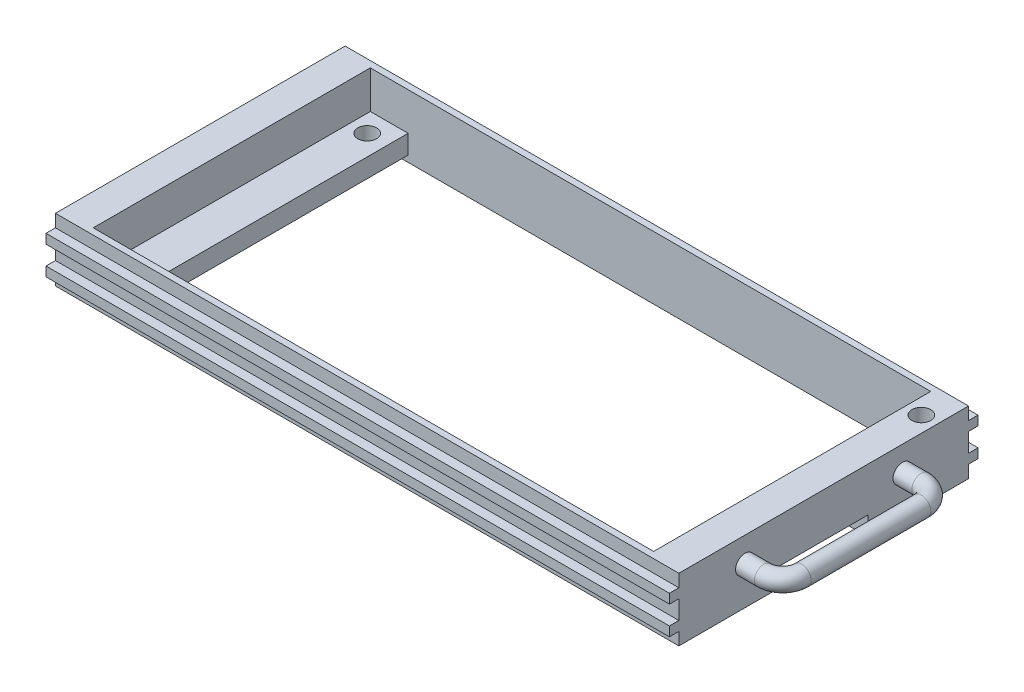
from build123d import *

# Parameters (mm, degrees)
SKETCH1_W           = 99
SKETCH1_H           = 46
SKETCH1_W_2         = 89
SKETCH1_H_2         = 44
BOSS_EXTRUDE1_DEPTH = 10
SKETCH2_W           = 99
SKETCH2_H           = 1.5
BOSS_EXTRUDE2_DEPTH = 1.5
SKETCH4_W           = 6
SKETCH4_H           = 44
BOSS_EXTRUDE3_DEPTH = 4
SKETCH5_R           = 1.5
CUT_EXTRUDE1_DEPTH  = 4
SKETCH6_W           = 6
SKETCH6_H           = 44
CUT_EXTRUDE2_DEPTH  = 1
CUT_EXTRUDE3_REACH  = 104.476
SKETCH7_W           = 14
SKETCH7_H           = 3
SWEEP3_PROFILE_R    = 1.5
SKETCH23_R          = 1.5
CUT_EXTRUDE4_DEPTH  = 10


with BuildPart() as part:
    # Sketch1 → Boss-Extrude1 (new body)
    with BuildSketch(Plane(origin=(0, 0, 0), x_dir=(1, 0, 0), z_dir=(0, 1, 0))):
        Rectangle(SKETCH1_W, SKETCH1_H)
        Rectangle(SKETCH1_W_2, SKETCH1_H_2, mode=Mode.SUBTRACT)
    extrude(amount=BOSS_EXTRUDE1_DEPTH)

    # Sketch2 → Boss-Extrude2 (add)
    with BuildSketch(Plane.XY.offset(23)):
        with Locations((0, 2.75)):
            Rectangle(SKETCH2_W, SKETCH2_H)
        with Locations((0, 7.25)):
            Rectangle(SKETCH2_W, SKETCH2_H)
    boss_extrude2 = extrude(amount=BOSS_EXTRUDE2_DEPTH)

    # Mirror1: Boss-Extrude2 across plane
    add(boss_extrude2.mirror(Plane.XY))

    # Sketch4 → Boss-Extrude3 (add)
    with BuildSketch(Plane(origin=(0, 0, 0), x_dir=(1, 0, 0), z_dir=(0, 1, 0))):
        with Locations((-41.5, 0)):
            Rectangle(SKETCH4_W, SKETCH4_H)
    boss_extrude3 = extrude(amount=BOSS_EXTRUDE3_DEPTH)

    # Mirror2: Boss-Extrude3 across plane
    add(boss_extrude3.mirror(Plane(origin=(0, 0, 0), x_dir=(0, 0, 1), z_dir=(1, 0, 0))))

    # Sketch5 → Cut-Extrude1 (cut)
    with BuildSketch(Plane(origin=(0, 4, 0), x_dir=(1, 0, 0), z_dir=(0, 1, 0))):
        with Locations(Location((-41.75, 18.75, 0), (0, 0, 270))):
            Circle(SKETCH5_R)
        with Locations(Location((-41.75, -18.75, 0), (0, 0, 90))):
            Circle(SKETCH5_R)
    cut_extrude1 = extrude(amount=-CUT_EXTRUDE1_DEPTH, mode=Mode.SUBTRACT)

    # Mirror3: Cut-Extrude1 across plane
    add(cut_extrude1.mirror(Plane(origin=(0, 0, 0), x_dir=(0, 0, 1), z_dir=(1, 0, 0))), mode=Mode.SUBTRACT)

    # Sketch6 → Cut-Extrude2 (cut)
    with BuildSketch(Plane.XZ):
        with Locations((-41.5, 0)):
            Rectangle(SKETCH6_W, SKETCH6_H)
        with Locations((41.5, 0)):
            Rectangle(SKETCH6_W, SKETCH6_H)
    extrude(amount=-CUT_EXTRUDE2_DEPTH, mode=Mode.SUBTRACT)

    # Cut-Extrude3: up to this face of the body (flat: up to its plane)
    cut_extrude3_end = Plane(part.part.faces().sort_by_distance((38.5, 2.5, 0))[0])
    # Sketch7 → Cut-Extrude3 (cut, up to the picked face)
    with BuildSketch(Plane(origin=(49.5, 0, 0), x_dir=(0, 0, -1), z_dir=(1, 0, 0)), mode=Mode.PRIVATE) as cut_extrude3_sk1:
        with Locations((0, 1.5)):
            Rectangle(SKETCH7_W, SKETCH7_H)
    cut_extrude3_tool1 = split(extrude(cut_extrude3_sk1.sketch, amount=-CUT_EXTRUDE3_REACH, mode=Mode.PRIVATE), bisect_by=cut_extrude3_end, keep=Keep.BOTH, mode=Mode.PRIVATE)
    add(cut_extrude3_tool1.solids().sort_by(Axis((49.5, 1.5, 0), (-1, 0, 0)))[0], mode=Mode.SUBTRACT)

    # Sweep3: sweep along a path in Sketch9
    with BuildLine(Plane(origin=(0, 6, 0), x_dir=(1, 0, 0), z_dir=(0, 1, 0))) as sweep3_path:
        Line((49.5, 12.5), (52.5, 12.5))
        ThreePointArc((52.5, 12.5), (54.621320344, 11.621320344), (55.5, 9.5))
        Line((55.5, 9.5), (55.5, -9.5))
        ThreePointArc((55.5, -9.5), (54.621320344, -11.621320344), (52.5, -12.5))
        Line((52.5, -12.5), (49.5, -12.5))
    # Sweep3 profile (on start of the path) → Sweep3 (sweep)
    with BuildSketch(Plane(origin=(49.5, 6, -12.5), x_dir=(0, 0, 1), z_dir=(1, 0, 0))):
        Circle(SWEEP3_PROFILE_R)
    sweep(path=sweep3_path.line)

    # Sketch23 → Cut-Extrude4 (cut)
    with BuildSketch(Plane(origin=(0, 10, 0), x_dir=(1, 0, 0), z_dir=(0, 1, 0))):
        with Locations(Location((47, 18, 0), (0, 0, 270))):
            Circle(SKETCH23_R)
    extrude(amount=-CUT_EXTRUDE4_DEPTH, mode=Mode.SUBTRACT)


solid = part.part
